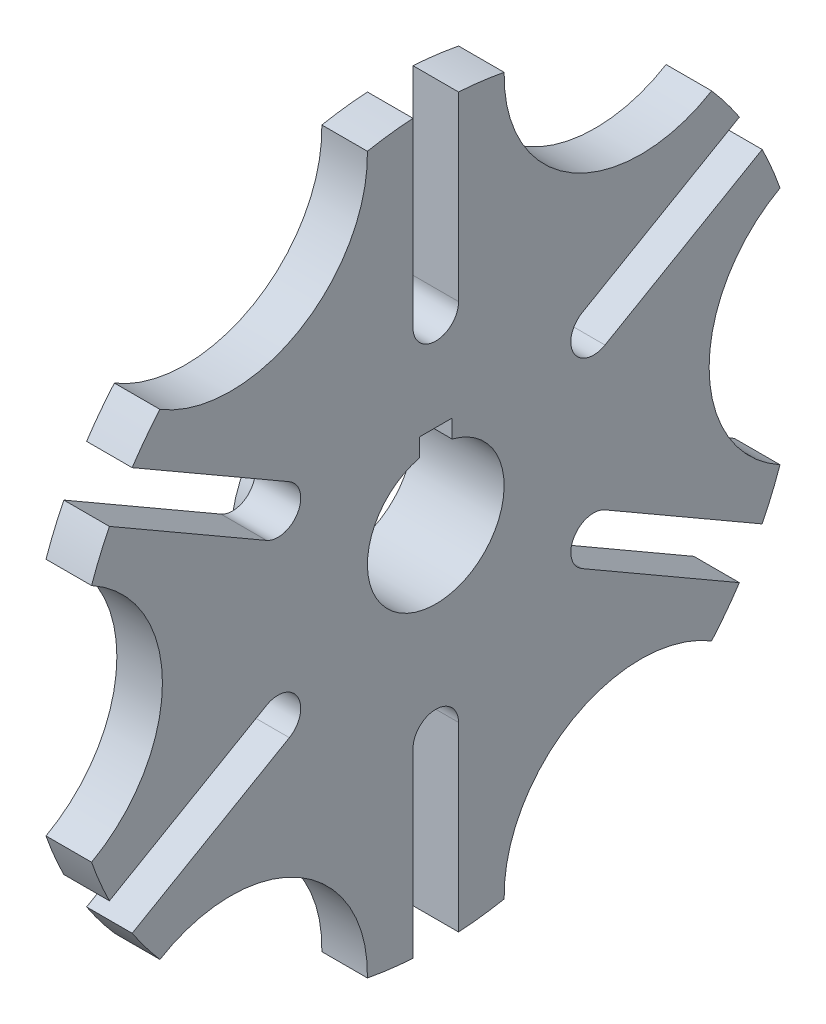
from build123d import *

# Parameters (mm, degrees)
SKETCH1_R           = 101.6
BOSS_EXTRUDE1_DEPTH = 12.7
CUT_EXTRUDE1_DEPTH  = 145.244271983
CIRPATTERN1_COUNT   = 6
CUT_EXTRUDE2_START  = -12.7
CUT_EXTRUDE2_DEPTH  = 12.7
CIRPATTERN2_COUNT   = 6
SKETCH4_R           = 31.75
BOSS_EXTRUDE2_DEPTH = 25.4
SKETCH7_R           = 19.05
SKETCH7_W           = 9.144
SKETCH7_H           = 5.08
CUT_EXTRUDE5_DEPTH  = 142.897378912
FILLET1_R           = 6.35


with BuildPart() as part:
    # Sketch1 → Boss-Extrude1 (new body)
    with BuildSketch(Plane(origin=(0, 0, 0), x_dir=(0, 0, -1), z_dir=(1, 0, 0))):
        Circle(SKETCH1_R)
    extrude(amount=BOSS_EXTRUDE1_DEPTH)

    # Sketch2 → Cut-Extrude1 (cut, symmetric)
    with BuildSketch(Plane(origin=(12.7, 0, 0), x_dir=(0, 0, -1), z_dir=(1, 0, 0))):
        with BuildLine():
            Line((6.35, 50.8), (6.35, 101.401368334))
            ThreePointArc((6.35, 101.401368334), (0, 101.6), (-6.35, 101.401368334))
            Line((-6.35, 101.401368334), (-6.35, 50.8))
            ThreePointArc((-6.35, 50.8), (0, 44.45), (6.35, 50.8))
        make_face()
    cut_extrude1 = extrude(amount=CUT_EXTRUDE1_DEPTH, both=True, mode=Mode.SUBTRACT)

    # CirPattern1: Cut-Extrude1 ×6 about axis
    cirpattern1_axis = Axis((12.7, 0, 0), (-1, 0, 0))
    for i in range(1, CIRPATTERN1_COUNT):
        add(cut_extrude1.rotate(cirpattern1_axis, i * 360 / CIRPATTERN1_COUNT), mode=Mode.SUBTRACT)

    # Sketch3 → Cut-Extrude2 (cut)
    with BuildSketch(Plane(origin=(12.7, 0, 0), x_dir=(0, 0, -1), z_dir=(1, 0, 0)).offset(CUT_EXTRUDE2_START)):
        with BuildLine():
            ThreePointArc((-76.2, 0), (-81.508741002, 19.399570442), (-95.955555556, 33.392983665))
            ThreePointArc((-95.955555556, 33.392983665), (-101.6, 0), (-95.955555556, -33.392983665))
            ThreePointArc((-95.955555556, -33.392983665), (-81.508741002, -19.399570442), (-76.2, 0))
        make_face()
    cut_extrude2 = extrude(amount=CUT_EXTRUDE2_DEPTH, mode=Mode.SUBTRACT)

    # CirPattern2: Cut-Extrude2 ×6 about axis
    cirpattern2_axis = Axis((0, 0, 0), (1, 0, 0))
    for i in range(1, CIRPATTERN2_COUNT):
        add(cut_extrude2.rotate(cirpattern2_axis, i * 360 / CIRPATTERN2_COUNT), mode=Mode.SUBTRACT)

    # Sketch4 → Boss-Extrude2 (add)
    with BuildSketch(Plane(origin=(12.7, 0, 0), x_dir=(0, 0, -1), z_dir=(1, 0, 0))):
        Circle(SKETCH4_R)
    extrude(amount=-BOSS_EXTRUDE2_DEPTH)

    # Sketch7 → Cut-Extrude5 (cut, through all)
    with BuildSketch(Plane.ZY.offset(12.7)):
        Circle(SKETCH7_R)
        with Locations((0, 21.033223516)):
            Rectangle(SKETCH7_W, SKETCH7_H)
    extrude(amount=-CUT_EXTRUDE5_DEPTH, mode=Mode.SUBTRACT)

    # Fillet1
    fillet1_edges = [part.edges().sort_by_distance(p)[0] for p in [
        (0, 0, 31.75),
    ]]
    fillet(fillet1_edges, radius=FILLET1_R)


solid = part.part
